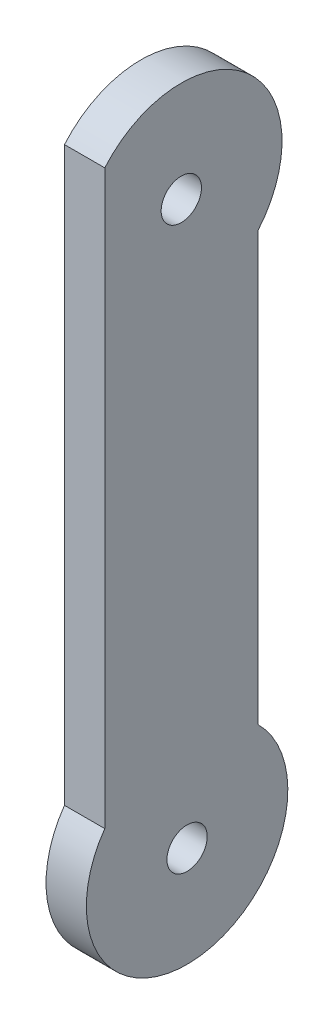
from build123d import *

# Parameters (mm, degrees)
BOSS_EXTRUDE1_DEPTH = 10
SKETCH2_R           = 5
CUT_EXTRUDE1_DEPTH  = 10


with BuildPart() as part:
    # Sketch1 → Boss-Extrude1 (new body)
    with BuildSketch(Plane(origin=(0, 0, 0), x_dir=(0, 0, -1), z_dir=(1, 0, 0))):
        with BuildLine():
            Line((-21.740371833, 79.334768558), (-21.740371833, -62.665231442))
            ThreePointArc((-21.740371833, -62.665231442), (0.913088354, -101.975272876), (16.2428669, -59.273323206))
            Line((16.2428669, -59.273323206), (16.2428669, 46.819025058))
            ThreePointArc((16.2428669, 46.819025058), (13.509119284, 82.068516174), (-21.740371833, 79.334768558))
        make_face()
    extrude(amount=BOSS_EXTRUDE1_DEPTH)

    # Sketch2 → Cut-Extrude1 (cut)
    with BuildSketch(Plane(origin=(10, 0, 0), x_dir=(0, 0, -1), z_dir=(1, 0, 0))):
        with Locations((-2.748752466, 63.076896808)):
            Circle(SKETCH2_R)
        with Locations((-1.310566273, -77.074362047)):
            Circle(SKETCH2_R)
    extrude(amount=-CUT_EXTRUDE1_DEPTH, mode=Mode.SUBTRACT)


solid = part.part
